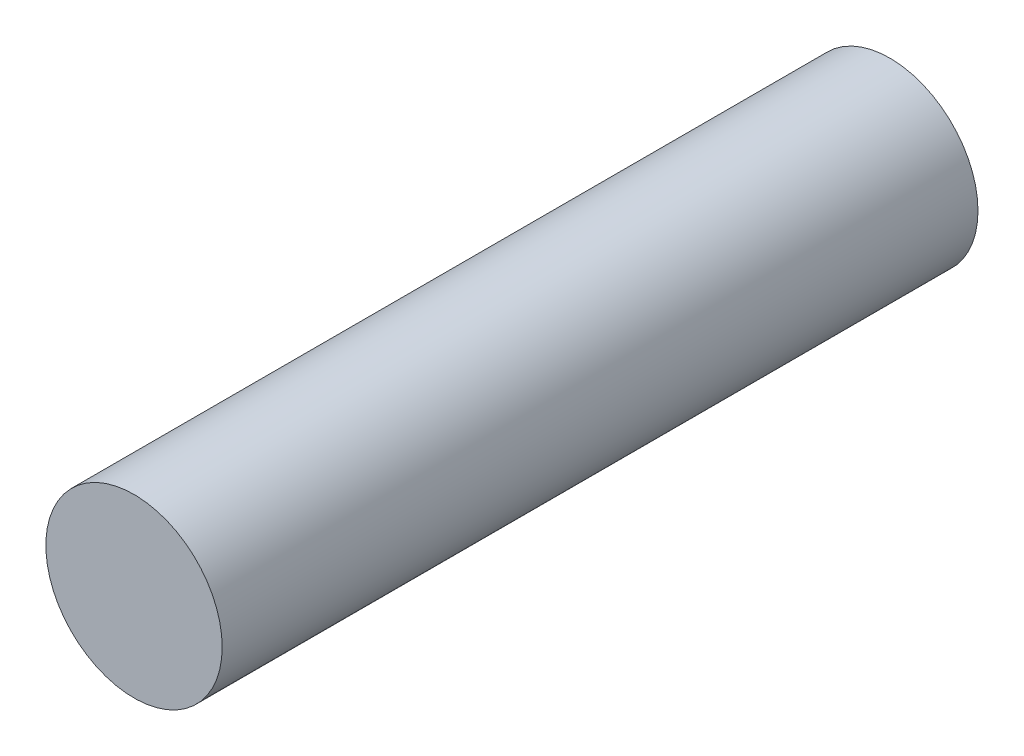
from build123d import *

# Parameters (mm, degrees)
SKETCH1_R           = 7
BOSS_EXTRUDE1_DEPTH = 60


with BuildPart() as part:
    # Sketch1 → Boss-Extrude1 (new body)
    with BuildSketch(Plane.XY):
        with Locations((-186.657193055, -243)):
            Circle(SKETCH1_R)
    extrude(amount=BOSS_EXTRUDE1_DEPTH)


solid = part.part
